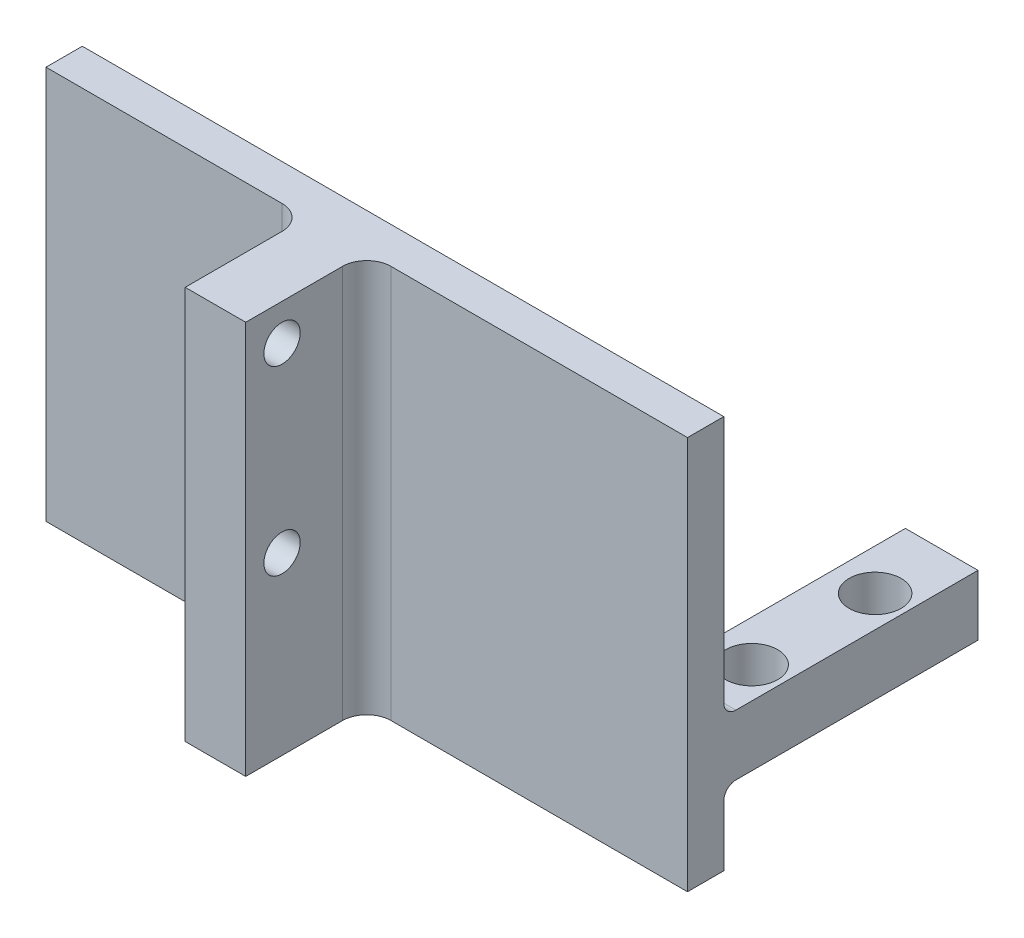
from build123d import *

# Parameters (mm, degrees)
SKETCH1_W           = 53
SKETCH1_H           = 32.5
BOSS_EXTRUDE1_DEPTH = 3
SKETCH2_W           = 6
SKETCH2_H           = 5
BOSS_EXTRUDE2_DEPTH = 21
FILLET1_R           = 1
SKETCH3_W           = 5
SKETCH3_H           = 32.5
BOSS_EXTRUDE3_DEPTH = 10
FILLET2_R           = 2
SKETCH4_R           = 2.15
CUT_EXTRUDE1_DEPTH  = 10
SKETCH5_R           = 1.5
CUT_EXTRUDE2_DEPTH  = 10


with BuildPart() as part:
    # Sketch1 → Boss-Extrude1 (new body)
    with BuildSketch(Plane.XY):
        with Locations((0, 5.25)):
            Rectangle(SKETCH1_W, SKETCH1_H)
    extrude(amount=BOSS_EXTRUDE1_DEPTH)

    # Sketch2 → Boss-Extrude2 (add)
    with BuildSketch(Plane(origin=(0, 0, 0), x_dir=(-1, 0, 0), z_dir=(0, 0, -1))):
        with Locations((23.5, -2.5)):
            Rectangle(SKETCH2_W, SKETCH2_H)
        with Locations((-23.5, -2.5)):
            Rectangle(SKETCH2_W, SKETCH2_H)
    extrude(amount=BOSS_EXTRUDE2_DEPTH)

    # Fillet1
    fillet1_edges = [part.edges().sort_by_distance(p)[0] for p in [
        (23.5, 0, 0),
        (23.5, -5, 0),
        (-23.5, 0, 0),
        (-23.5, -5, 0),
    ]]
    fillet(fillet1_edges, radius=FILLET1_R)

    # Sketch3 → Boss-Extrude3 (add)
    with BuildSketch(Plane.XY.offset(3)):
        with Locations((-2.5, 5.25)):
            Rectangle(SKETCH3_W, SKETCH3_H)
    extrude(amount=BOSS_EXTRUDE3_DEPTH)

    # Fillet2
    fillet2_edges = [part.edges().sort_by_distance(p)[0] for p in [
        (-5, 5.25, 3),
        (0, 5.25, 3),
    ]]
    fillet(fillet2_edges, radius=FILLET2_R)

    # Sketch4 → Cut-Extrude1 (cut)
    with BuildSketch(Plane.XZ.offset(5)):
        with Locations(Location((23.9, -4.9, 0), (0, 0, 270))):
            Circle(SKETCH4_R)
        with Locations(Location((23.9, -15.1, 0), (0, 0, 270))):
            Circle(SKETCH4_R)
        with Locations(Location((-23.9, -4.9, 0), (0, 0, 270))):
            Circle(SKETCH4_R)
        with Locations(Location((-23.9, -15.1, 0), (0, 0, 270))):
            Circle(SKETCH4_R)
    extrude(amount=-CUT_EXTRUDE1_DEPTH, mode=Mode.SUBTRACT)

    # Sketch5 → Cut-Extrude2 (cut)
    with BuildSketch(Plane(origin=(0, 0, 0), x_dir=(0, 0, -1), z_dir=(1, 0, 0))):
        with Locations(Location((-10, 18.5, 0), (0, 0, 90))):
            Circle(SKETCH5_R)
        with Locations(Location((-10, 3.5, 0), (0, 0, 90))):
            Circle(SKETCH5_R)
    extrude(amount=-CUT_EXTRUDE2_DEPTH, mode=Mode.SUBTRACT)


solid = part.part
